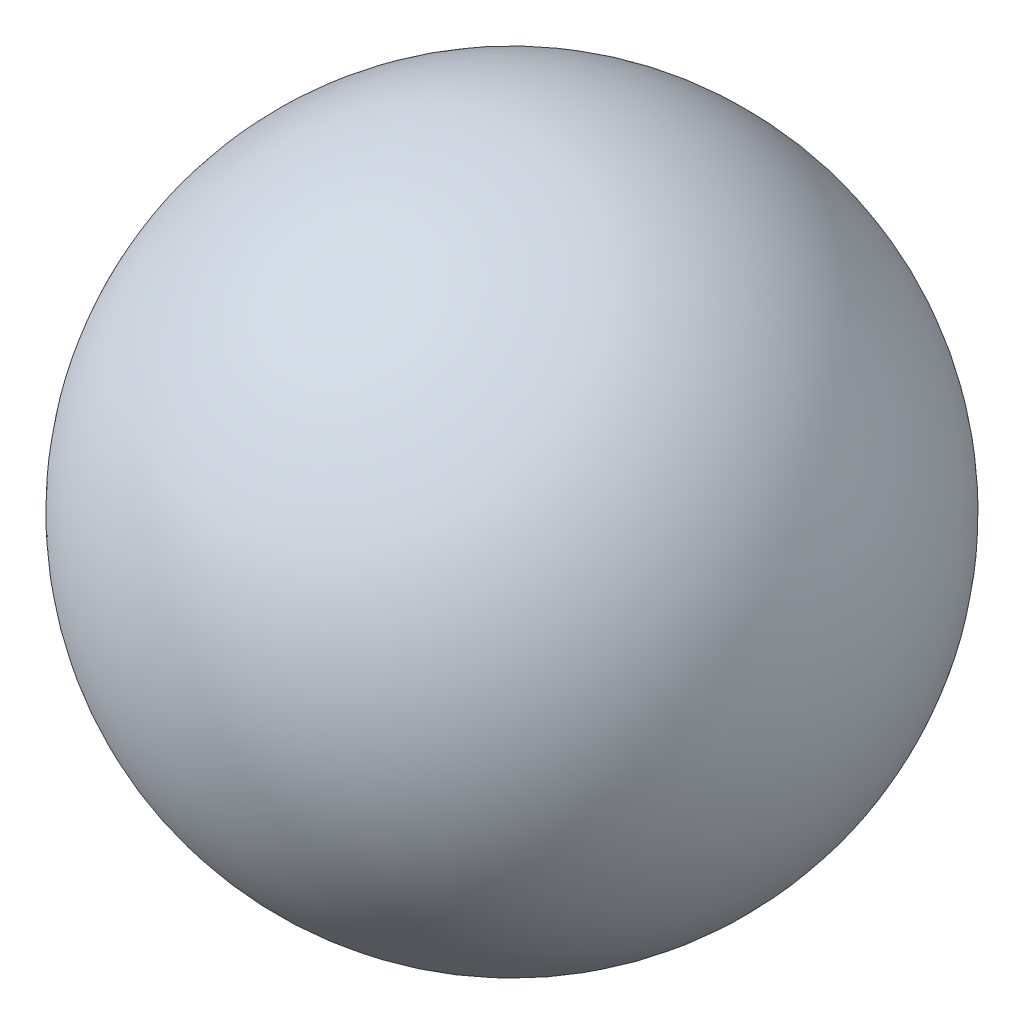
from build123d import *


with BuildPart() as part:
    # Esquisse1 → Base-Révolution (revolve)
    with BuildSketch(Plane.XY):
        with BuildLine():
            Line((-2.25, 0), (2.25, 0))
            ThreePointArc((2.25, 0), (0, -2.25), (-2.25, 0))
        make_face()
    revolve(axis=Axis((-10, 0, 0), (1, 0, 0)))


solid = part.part
